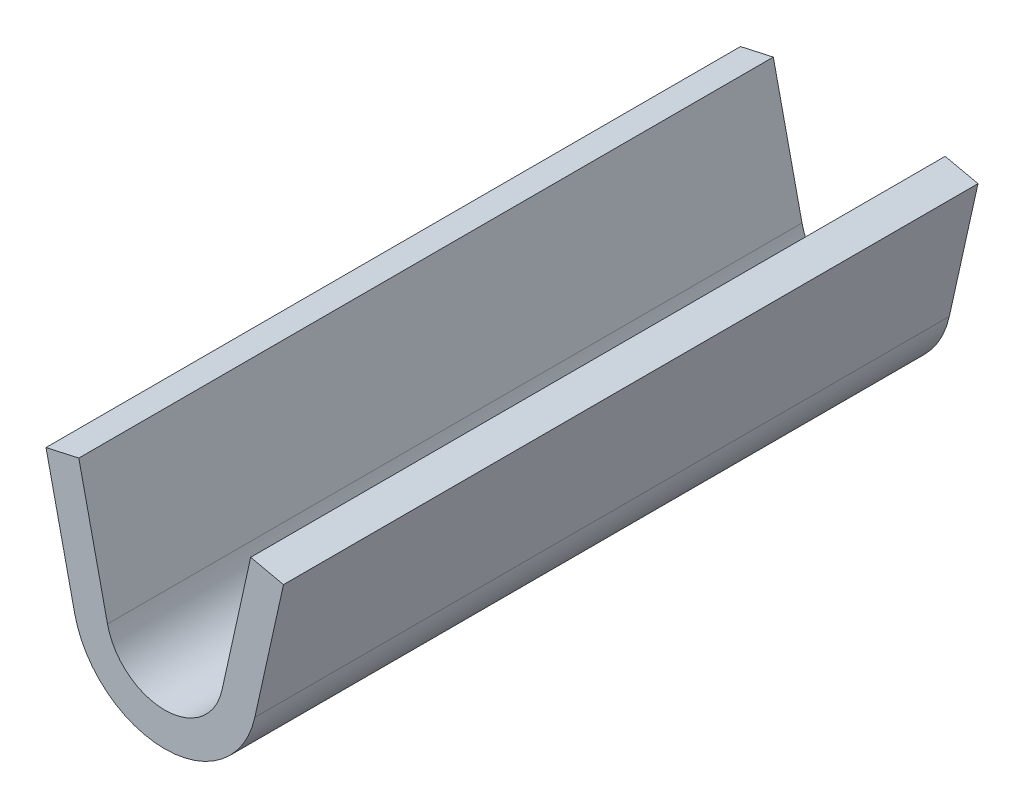
from build123d import *

# Parameters (mm, degrees)
EXTRUDE_THIN1_DEPTH = 3.1


with BuildPart() as part:
    # Sketch1 → Extrude-Thin1 (new body)
    with BuildSketch(Plane.XY):
        with BuildLine():
            Line((0.53, 0.488236929), (0.402002643, -0.08912184))
            ThreePointArc((0.402002643, -0.08912184), (0, -0.411763071), (-0.402002643, -0.08912184))
            Line((-0.402002643, -0.08912184), (-0.53, 0.488236929))
            Line((-0.53, 0.488236929), (-0.383555599, 0.520702871))
            Line((-0.383555599, 0.520702871), (-0.255558241, -0.056655898))
            ThreePointArc((-0.255558241, -0.056655898), (0, -0.261763071), (0.255558241, -0.056655898))
            Line((0.255558241, -0.056655898), (0.383555599, 0.520702871))
            Line((0.383555599, 0.520702871), (0.53, 0.488236929))
        make_face()
    extrude(amount=EXTRUDE_THIN1_DEPTH)


solid = part.part
